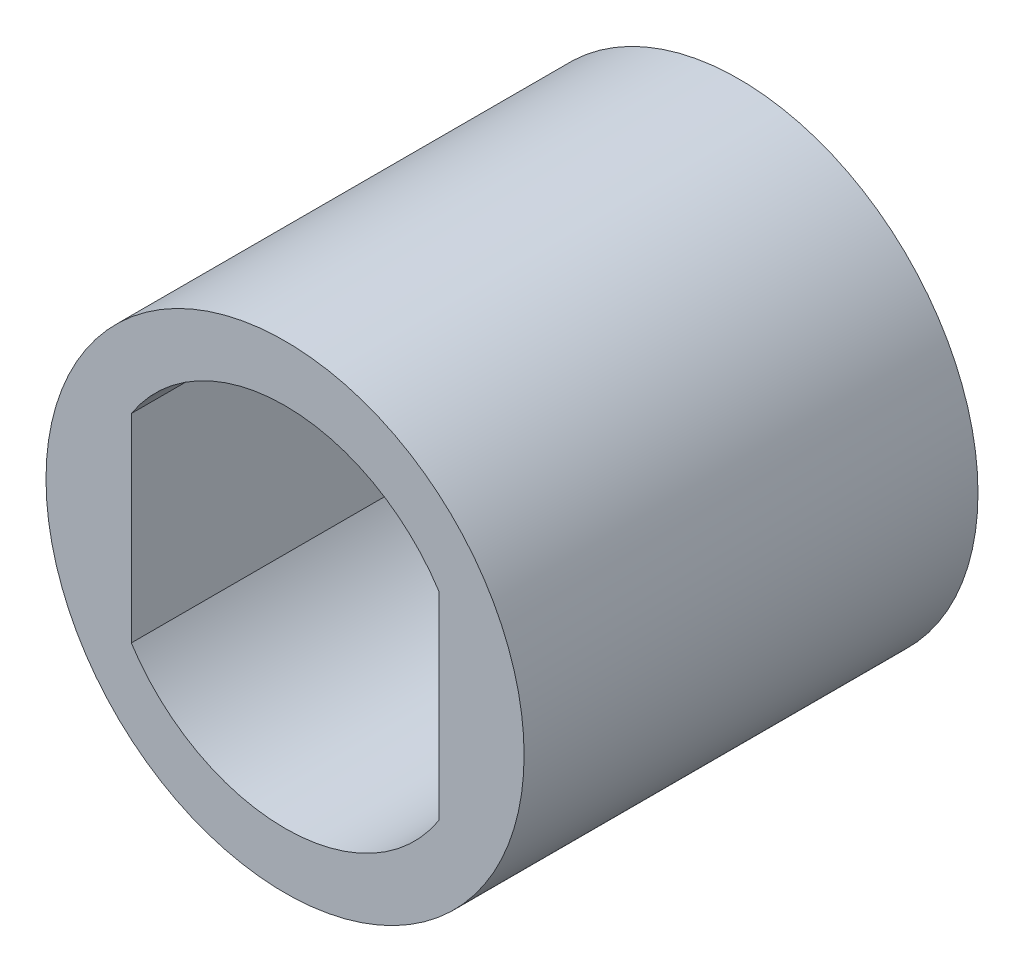
from build123d import *

# Parameters (mm, degrees)
SKETCH_1_R      = 7.9
EXTRUDE_1_DEPTH = 15


with BuildPart() as part:
    # 草图1 → 凸台-拉伸1 (new body)
    with BuildSketch(Plane.XY):
        Circle(SKETCH_1_R)
        with BuildLine():
            Line((-5.082, 3.282647712), (-5.082, -3.282647712))
            ThreePointArc((-5.082, -3.282647712), (0, -6.05), (5.082, -3.282647712))
            Line((5.082, -3.282647712), (5.082, 3.282647712))
            ThreePointArc((5.082, 3.282647712), (0, 6.05), (-5.082, 3.282647712))
        make_face(mode=Mode.SUBTRACT)
    extrude(amount=EXTRUDE_1_DEPTH)


solid = part.part
